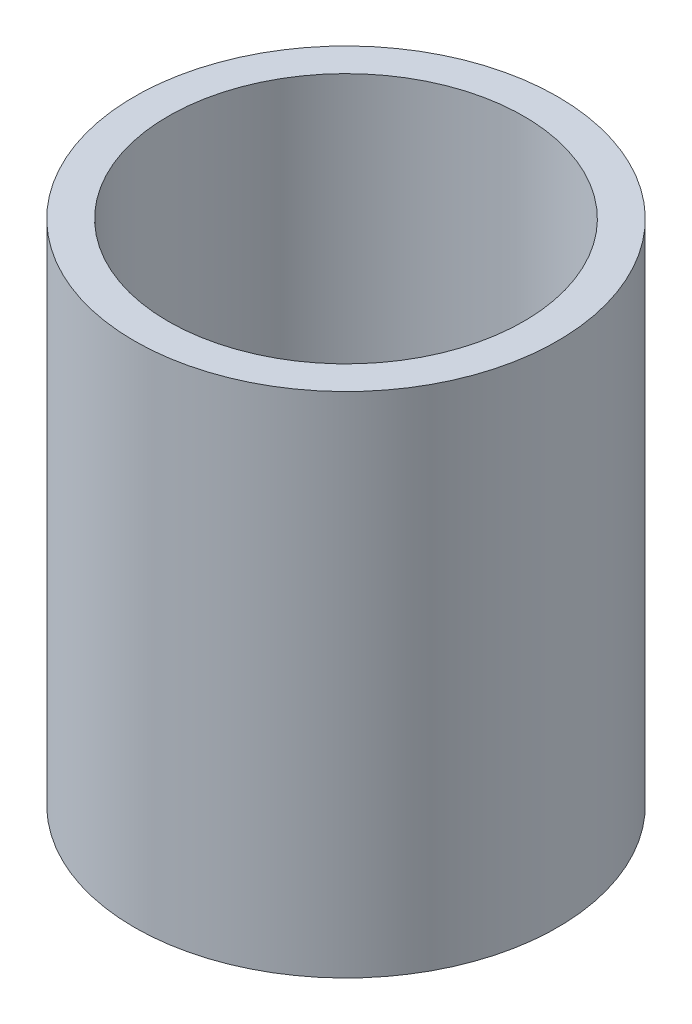
from build123d import *

# Parameters (mm, degrees)
SKETCH1_R           = 12.5
SKETCH1_R_2         = 10.5
BOSS_EXTRUDE1_DEPTH = 30


with BuildPart() as part:
    # Sketch1 → Boss-Extrude1 (new body)
    with BuildSketch(Plane(origin=(0, 0, 0), x_dir=(1, 0, 0), z_dir=(0, 1, 0))):
        Circle(SKETCH1_R)
        Circle(SKETCH1_R_2, mode=Mode.SUBTRACT)
    extrude(amount=BOSS_EXTRUDE1_DEPTH)


solid = part.part
